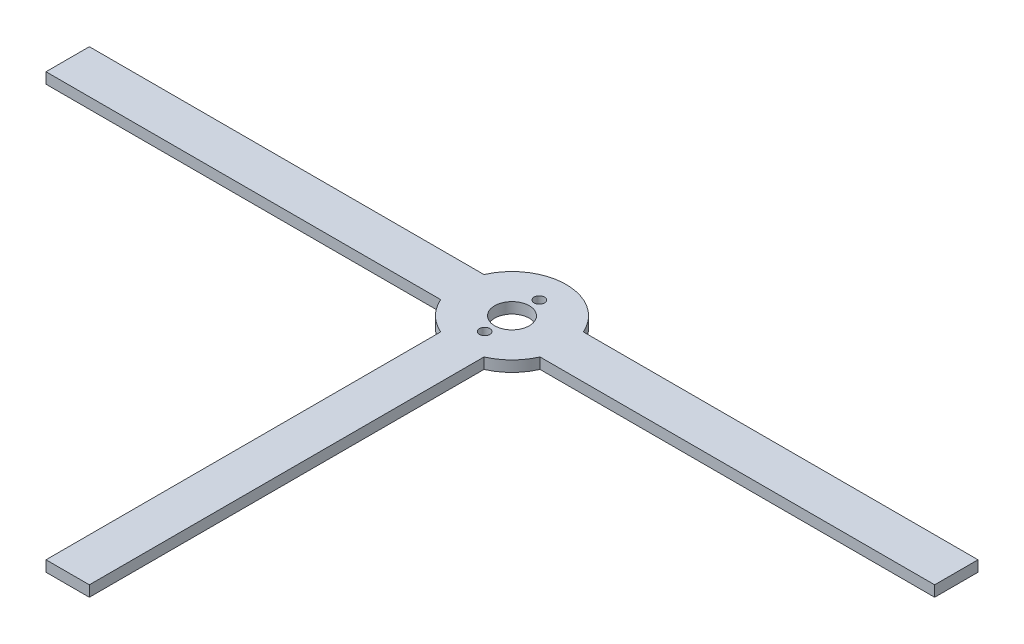
from build123d import *

# Parameters (mm, degrees)
BOSS_EXTRUDE1_DEPTH = 3.175
SCREW_HOLES_R       = 1.513296856
SCREW_HOLES_R_2     = 5.08
CUT_EXTRUDE1_DEPTH  = 185.122627276


with BuildPart() as part:
    # Sketch1 → Boss-Extrude1 (new body)
    with BuildSketch(Plane(origin=(0, 0, 0), x_dir=(1, 0, 0), z_dir=(0, 1, 0))):
        with BuildLine():
            Line((-14.549677831, 6.35), (-130.175, 6.35))
            Line((-130.175, 6.35), (-130.175, -6.35))
            Line((-130.175, -6.35), (-14.549677831, -6.35))
            ThreePointArc((-14.549677831, -6.35), (-11.225320151, -11.225320151), (-6.35, -14.549677831))
            Line((-6.35, -14.549677831), (-6.35, -130.175))
            Line((-6.35, -130.175), (6.35, -130.175))
            Line((6.35, -130.175), (6.35, -14.549677831))
            ThreePointArc((6.35, -14.549677831), (11.225320151, -11.225320151), (14.549677831, -6.35))
            Line((14.549677831, -6.35), (130.175, -6.35))
            Line((130.175, -6.35), (130.175, 6.35))
            Line((130.175, 6.35), (14.549677831, 6.35))
            ThreePointArc((14.549677831, 6.35), (0, 15.875), (-14.549677831, 6.35))
        make_face()
    extrude(amount=BOSS_EXTRUDE1_DEPTH)

    # Screw holes → Cut-Extrude1 (cut, through all)
    with BuildSketch(Plane(origin=(0, 0, 0), x_dir=(1, 0, 0), z_dir=(0, 1, 0))):
        with Locations(Location((0, 8, 0), (0, 0, 270))):
            Circle(SCREW_HOLES_R)
        with Locations(Location((0, -8, 0), (0, 0, 270))):
            Circle(SCREW_HOLES_R)
        with Locations(Location((0, 0, 0), (0, 0, 270))):
            Circle(SCREW_HOLES_R_2)
    extrude(amount=CUT_EXTRUDE1_DEPTH, mode=Mode.SUBTRACT)


solid = part.part
